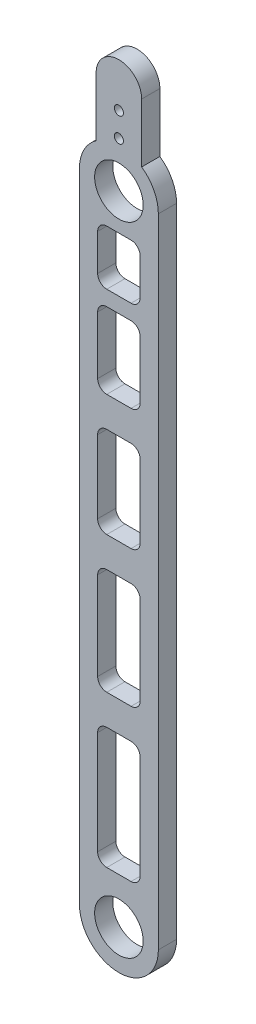
from build123d import *

# Parameters (mm, degrees)
SKETCH_1_R          = 8
EXTRUDE_1_DEPTH     = 6
SKETCH_2_R          = 1.5
SKETCH_2_W          = 14
SKETCH_2_H          = 25
SKETCH_2_H_2        = 30
SKETCH_2_H_3        = 35
SKETCH_2_H_4        = 40
SKETCH_2_H_5        = 18
CUT_EXTRUDE_1_DEPTH = 248.913795502
FILLET_1_R          = 3


with BuildPart() as part:
    # 草图1 → 凸台-拉伸1 (new body)
    with BuildSketch(Plane.XY):
        with BuildLine():
            Line((-13, 0), (-13, 210))
            ThreePointArc((-13, 210), (-11.543396381, 215.979130372), (-7.5, 220.618380291))
            Line((-7.5, 220.618380291), (-7.5, 240))
            ThreePointArc((-7.5, 240), (0, 247.5), (7.5, 240))
            Line((7.5, 240), (7.5, 220.618380291))
            ThreePointArc((7.5, 220.618380291), (11.543396381, 215.979130372), (13, 210))
            Line((13, 210), (13, 0))
            ThreePointArc((13, 0), (0, -13), (-13, 0))
        make_face()
        Circle(SKETCH_1_R, mode=Mode.SUBTRACT)
        with Locations((0, 210)):
            Circle(SKETCH_1_R, mode=Mode.SUBTRACT)
    extrude(amount=EXTRUDE_1_DEPTH)

    # 草图2 → 切除-拉伸1 (cut, through all)
    with BuildSketch(Plane.XY.offset(6)):
        with Locations((0, 233)):
            Circle(SKETCH_2_R)
        with Locations((0, 225)):
            Circle(SKETCH_2_R)
        with Locations((0, 162.5)):
            Rectangle(SKETCH_2_W, SKETCH_2_H)
        with Locations((0, 125)):
            Rectangle(SKETCH_2_W, SKETCH_2_H_2)
        with Locations((0, 82.5)):
            Rectangle(SKETCH_2_W, SKETCH_2_H_3)
        with Locations((0, 35)):
            Rectangle(SKETCH_2_W, SKETCH_2_H_4)
        with Locations((0, 189)):
            Rectangle(SKETCH_2_W, SKETCH_2_H_5)
    extrude(amount=-CUT_EXTRUDE_1_DEPTH, mode=Mode.SUBTRACT)

    # 圆角1
    fillet_1_edges = [part.edges().sort_by_distance(p)[0] for p in [
        (7, 55, 3),
        (7, 15, 3),
        (-7, 15, 3),
        (-7, 55, 3),
        (7, 100, 3),
        (7, 65, 3),
        (-7, 65, 3),
        (-7, 100, 3),
        (7, 140, 3),
        (7, 110, 3),
        (-7, 110, 3),
        (-7, 140, 3),
        (7, 198, 3),
        (7, 180, 3),
        (-7, 180, 3),
        (-7, 198, 3),
        (7, 175, 3),
        (7, 150, 3),
        (-7, 150, 3),
        (-7, 175, 3),
    ]]
    fillet(fillet_1_edges, radius=FILLET_1_R)


solid = part.part
